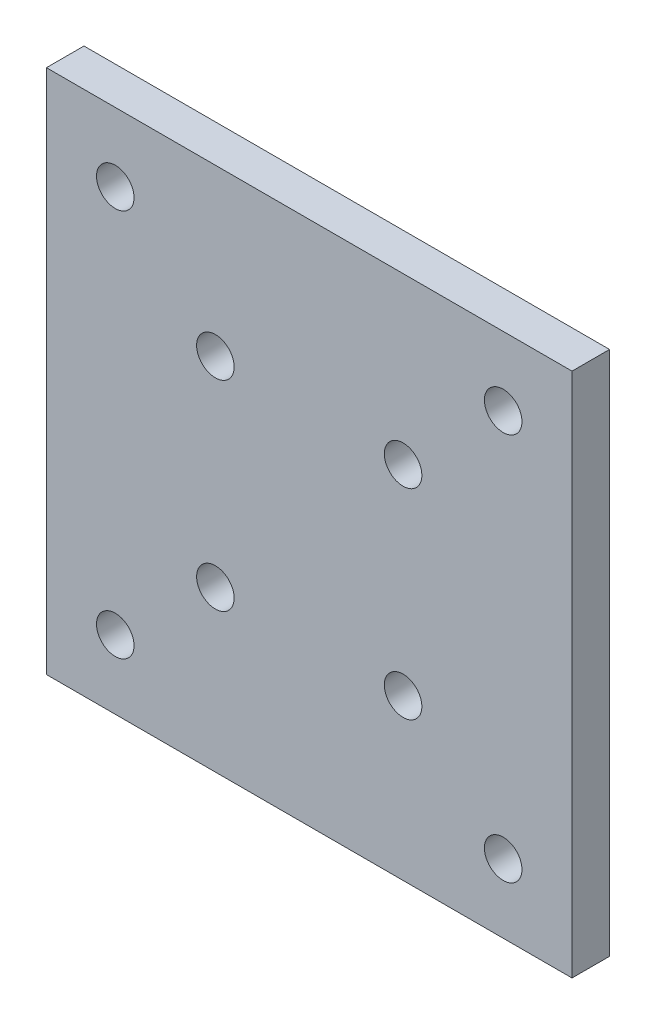
from build123d import *

# Parameters (mm, degrees)
SKETCH1_W           = 42
SKETCH1_H           = 42
SKETCH1_R           = 1.5
BOSS_EXTRUDE1_DEPTH = 3


with BuildPart() as part:
    # Sketch1 → Boss-Extrude1 (new body)
    with BuildSketch(Plane.XY):
        with Locations((21, 21)):
            Rectangle(SKETCH1_W, SKETCH1_H)
        with Locations((5.5, 36.5)):
            Circle(SKETCH1_R, mode=Mode.SUBTRACT)
        with Locations((36.5, 36.5)):
            Circle(SKETCH1_R, mode=Mode.SUBTRACT)
        with Locations((36.5, 5.5)):
            Circle(SKETCH1_R, mode=Mode.SUBTRACT)
        with Locations((5.5, 5.5)):
            Circle(SKETCH1_R, mode=Mode.SUBTRACT)
        with Locations((13.5, 28.78407244)):
            Circle(SKETCH1_R, mode=Mode.SUBTRACT)
        with Locations((28.5, 28.78407244)):
            Circle(SKETCH1_R, mode=Mode.SUBTRACT)
        with Locations((28.5, 12.78407244)):
            Circle(SKETCH1_R, mode=Mode.SUBTRACT)
        with Locations((13.5, 12.78407244)):
            Circle(SKETCH1_R, mode=Mode.SUBTRACT)
    extrude(amount=BOSS_EXTRUDE1_DEPTH)


solid = part.part
